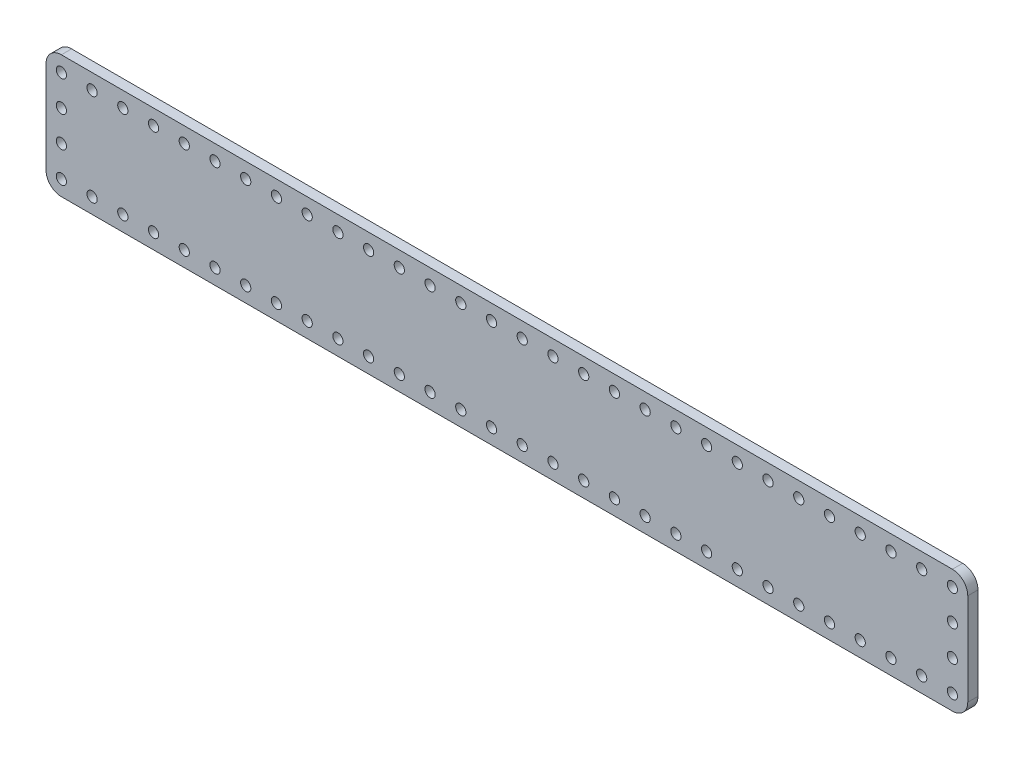
from build123d import *

# Parameters (mm, degrees)
MODEL_R                 = 1.5
SALIENTE_EXTRUIR1_DEPTH = 3


with BuildPart() as part:
    # Model → Saliente-Extruir1 (new body)
    with BuildSketch(Plane.XY):
        with BuildLine():
            Line((-105.943383637, 101.056539338), (-105.943383637, 74.056539338))
            ThreePointArc((-105.943383637, 74.056539338), (-104.625364152, 70.874558823), (-101.443383637, 69.556539338))
            Line((-101.443383637, 69.556539338), (159.556616363, 69.556539338))
            ThreePointArc((159.556616363, 69.556539338), (162.738596878, 70.874558823), (164.056616363, 74.056539338))
            Line((164.056616363, 74.056539338), (164.056616363, 101.056539338))
            ThreePointArc((164.056616363, 101.056539338), (162.738596878, 104.238519853), (159.556616363, 105.556539338))
            Line((159.556616363, 105.556539338), (-101.443383637, 105.556539338))
            ThreePointArc((-101.443383637, 105.556539338), (-104.625364152, 104.238519853), (-105.943383637, 101.056539338))
        make_face()
        with Locations((-101.443383637, 101.056539338)):
            Circle(MODEL_R, mode=Mode.SUBTRACT)
        with Locations((-92.443383637, 101.056539338)):
            Circle(MODEL_R, mode=Mode.SUBTRACT)
        with Locations((-83.443383637, 101.056539338)):
            Circle(MODEL_R, mode=Mode.SUBTRACT)
        with Locations((-74.443383637, 101.056539338)):
            Circle(MODEL_R, mode=Mode.SUBTRACT)
        with Locations((-65.443383637, 101.056539338)):
            Circle(MODEL_R, mode=Mode.SUBTRACT)
        with Locations((-56.443383637, 101.056539338)):
            Circle(MODEL_R, mode=Mode.SUBTRACT)
        with Locations((-47.443383637, 101.056539338)):
            Circle(MODEL_R, mode=Mode.SUBTRACT)
        with Locations((-38.443383637, 101.056539338)):
            Circle(MODEL_R, mode=Mode.SUBTRACT)
        with Locations((-101.443383637, 92.056539338)):
            Circle(MODEL_R, mode=Mode.SUBTRACT)
        with Locations((-101.443383637, 83.056539338)):
            Circle(MODEL_R, mode=Mode.SUBTRACT)
        with Locations((-101.443383637, 74.056539338)):
            Circle(MODEL_R, mode=Mode.SUBTRACT)
        with Locations((-92.443383637, 74.056539338)):
            Circle(MODEL_R, mode=Mode.SUBTRACT)
        with Locations((-83.443383637, 74.056539338)):
            Circle(MODEL_R, mode=Mode.SUBTRACT)
        with Locations((-74.443383637, 74.056539338)):
            Circle(MODEL_R, mode=Mode.SUBTRACT)
        with Locations((-65.443383637, 74.056539338)):
            Circle(MODEL_R, mode=Mode.SUBTRACT)
        with Locations((-56.443383637, 74.056539338)):
            Circle(MODEL_R, mode=Mode.SUBTRACT)
        with Locations((-47.443383637, 74.056539338)):
            Circle(MODEL_R, mode=Mode.SUBTRACT)
        with Locations((-38.443383637, 74.056539338)):
            Circle(MODEL_R, mode=Mode.SUBTRACT)
        with Locations((-29.443383637, 101.056539338)):
            Circle(MODEL_R, mode=Mode.SUBTRACT)
        with Locations((-29.443383637, 74.056539338)):
            Circle(MODEL_R, mode=Mode.SUBTRACT)
        with Locations((-20.443383637, 101.056539338)):
            Circle(MODEL_R, mode=Mode.SUBTRACT)
        with Locations((-20.443383637, 74.056539338)):
            Circle(MODEL_R, mode=Mode.SUBTRACT)
        with Locations((-11.443383637, 101.056539338)):
            Circle(MODEL_R, mode=Mode.SUBTRACT)
        with Locations((-2.443383637, 101.056539338)):
            Circle(MODEL_R, mode=Mode.SUBTRACT)
        with Locations((6.556616363, 101.056539338)):
            Circle(MODEL_R, mode=Mode.SUBTRACT)
        with Locations((15.556616363, 101.056539338)):
            Circle(MODEL_R, mode=Mode.SUBTRACT)
        with Locations((24.556616363, 101.056539338)):
            Circle(MODEL_R, mode=Mode.SUBTRACT)
        with Locations((33.556616363, 101.056539338)):
            Circle(MODEL_R, mode=Mode.SUBTRACT)
        with Locations((42.556616363, 101.056539338)):
            Circle(MODEL_R, mode=Mode.SUBTRACT)
        with Locations((51.556616363, 101.056539338)):
            Circle(MODEL_R, mode=Mode.SUBTRACT)
        with Locations((-11.443383637, 74.056539338)):
            Circle(MODEL_R, mode=Mode.SUBTRACT)
        with Locations((-2.443383637, 74.056539338)):
            Circle(MODEL_R, mode=Mode.SUBTRACT)
        with Locations((6.556616363, 74.056539338)):
            Circle(MODEL_R, mode=Mode.SUBTRACT)
        with Locations((15.556616363, 74.056539338)):
            Circle(MODEL_R, mode=Mode.SUBTRACT)
        with Locations((24.556616363, 74.056539338)):
            Circle(MODEL_R, mode=Mode.SUBTRACT)
        with Locations((33.556616363, 74.056539338)):
            Circle(MODEL_R, mode=Mode.SUBTRACT)
        with Locations((42.556616363, 74.056539338)):
            Circle(MODEL_R, mode=Mode.SUBTRACT)
        with Locations((51.556616363, 74.056539338)):
            Circle(MODEL_R, mode=Mode.SUBTRACT)
        with Locations((60.556616363, 101.056539338)):
            Circle(MODEL_R, mode=Mode.SUBTRACT)
        with Locations((60.556616363, 74.056539338)):
            Circle(MODEL_R, mode=Mode.SUBTRACT)
        with Locations((69.556616363, 101.056539338)):
            Circle(MODEL_R, mode=Mode.SUBTRACT)
        with Locations((69.556616363, 74.056539338)):
            Circle(MODEL_R, mode=Mode.SUBTRACT)
        with Locations((78.556616363, 101.056539338)):
            Circle(MODEL_R, mode=Mode.SUBTRACT)
        with Locations((87.556616363, 101.056539338)):
            Circle(MODEL_R, mode=Mode.SUBTRACT)
        with Locations((96.556616363, 101.056539338)):
            Circle(MODEL_R, mode=Mode.SUBTRACT)
        with Locations((105.556616363, 101.056539338)):
            Circle(MODEL_R, mode=Mode.SUBTRACT)
        with Locations((114.556616363, 101.056539338)):
            Circle(MODEL_R, mode=Mode.SUBTRACT)
        with Locations((123.556616363, 101.056539338)):
            Circle(MODEL_R, mode=Mode.SUBTRACT)
        with Locations((132.556616363, 101.056539338)):
            Circle(MODEL_R, mode=Mode.SUBTRACT)
        with Locations((141.556616363, 101.056539338)):
            Circle(MODEL_R, mode=Mode.SUBTRACT)
        with Locations((78.556616363, 74.056539338)):
            Circle(MODEL_R, mode=Mode.SUBTRACT)
        with Locations((87.556616363, 74.056539338)):
            Circle(MODEL_R, mode=Mode.SUBTRACT)
        with Locations((96.556616363, 74.056539338)):
            Circle(MODEL_R, mode=Mode.SUBTRACT)
        with Locations((105.556616363, 74.056539338)):
            Circle(MODEL_R, mode=Mode.SUBTRACT)
        with Locations((114.556616363, 74.056539338)):
            Circle(MODEL_R, mode=Mode.SUBTRACT)
        with Locations((123.556616363, 74.056539338)):
            Circle(MODEL_R, mode=Mode.SUBTRACT)
        with Locations((132.556616363, 74.056539338)):
            Circle(MODEL_R, mode=Mode.SUBTRACT)
        with Locations((141.556616363, 74.056539338)):
            Circle(MODEL_R, mode=Mode.SUBTRACT)
        with Locations((150.556616363, 101.056539338)):
            Circle(MODEL_R, mode=Mode.SUBTRACT)
        with Locations((150.556616363, 74.056539338)):
            Circle(MODEL_R, mode=Mode.SUBTRACT)
        with Locations((159.556616363, 101.056539338)):
            Circle(MODEL_R, mode=Mode.SUBTRACT)
        with Locations((159.556616363, 92.056539338)):
            Circle(MODEL_R, mode=Mode.SUBTRACT)
        with Locations((159.556616363, 83.056539338)):
            Circle(MODEL_R, mode=Mode.SUBTRACT)
        with Locations((159.556616363, 74.056539338)):
            Circle(MODEL_R, mode=Mode.SUBTRACT)
    extrude(amount=SALIENTE_EXTRUIR1_DEPTH)


solid = part.part
